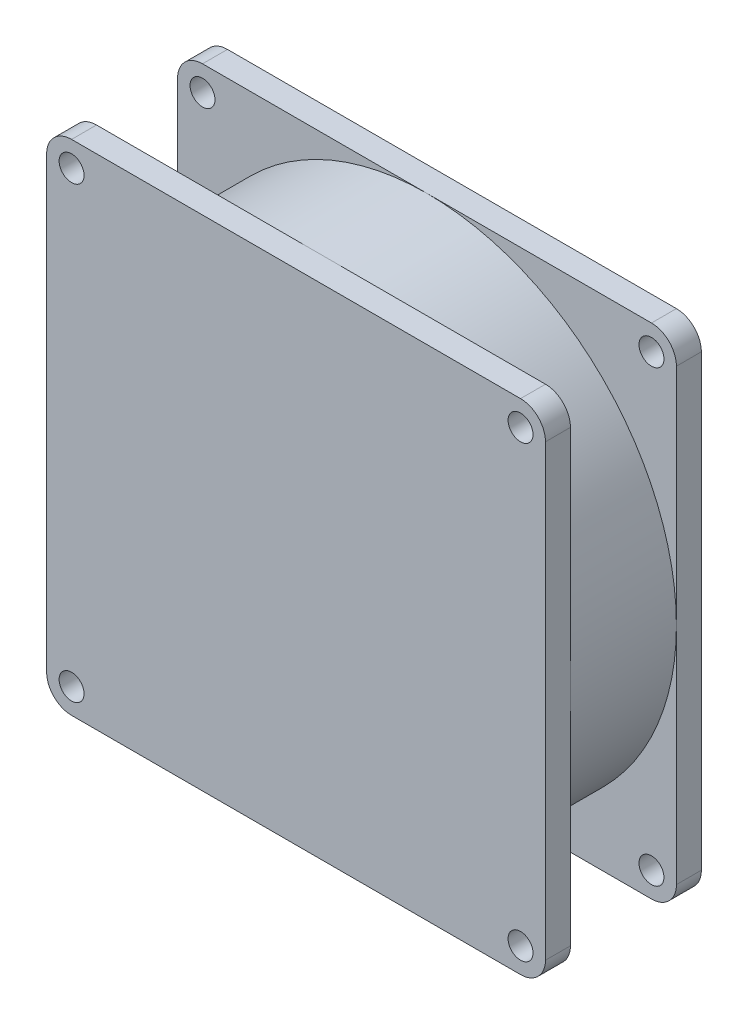
from build123d import *

# Parameters (mm, degrees)
SKETCH1_W             = 80
SKETCH1_H             = 80
BOSS_EXTRUDE1_DEPTH   = 4
FILLET2_R             = 4
SKETCH3_R             = 40
BOSS_EXTRUDE2_DEPTH   = 17
SKETCH4_W             = 80
SKETCH4_H             = 80
BOSS_EXTRUDE3_DEPTH   = 4
FILLET3_R             = 4
F_4_0MM_DOWEL_HOLE1_D = 4


with BuildPart() as part:
    # Sketch1 → Boss-Extrude1 (new body)
    with BuildSketch(Plane.XY):
        with Locations((40, 40)):
            Rectangle(SKETCH1_W, SKETCH1_H)
    extrude(amount=BOSS_EXTRUDE1_DEPTH)

    # Fillet2
    fillet2_edges = [part.edges().sort_by_distance(p)[0] for p in [
        (0, 0, 2),
        (0, 80, 2),
        (80, 80, 2),
        (80, 0, 2),
    ]]
    fillet(fillet2_edges, radius=FILLET2_R)

    # Sketch3 → Boss-Extrude2 (add)
    with BuildSketch(Plane.XY.offset(4)):
        with Locations((40, 40)):
            Circle(SKETCH3_R)
    extrude(amount=BOSS_EXTRUDE2_DEPTH)

    # Sketch4 → Boss-Extrude3 (add)
    with BuildSketch(Plane.XY.offset(21)):
        with Locations((40, 40)):
            Rectangle(SKETCH4_W, SKETCH4_H)
    extrude(amount=BOSS_EXTRUDE3_DEPTH)

    # Fillet3
    fillet3_edges = [part.edges().sort_by_distance(p)[0] for p in [
        (0, 80, 23),
        (0, 0, 23),
        (80, 0, 23),
        (80, 80, 23),
    ]]
    fillet(fillet3_edges, radius=FILLET3_R)

    # Ø4.0mm Dowel Hole1 (through all)
    with Locations(Plane(origin=(0, 0, 0), x_dir=(-1, 0, 0), z_dir=(0, 0, -1))):
        with Locations((-76, 76), (-4, 76), (-4, 4), (-76, 4)):
            Hole(F_4_0MM_DOWEL_HOLE1_D / 2)


solid = part.part
